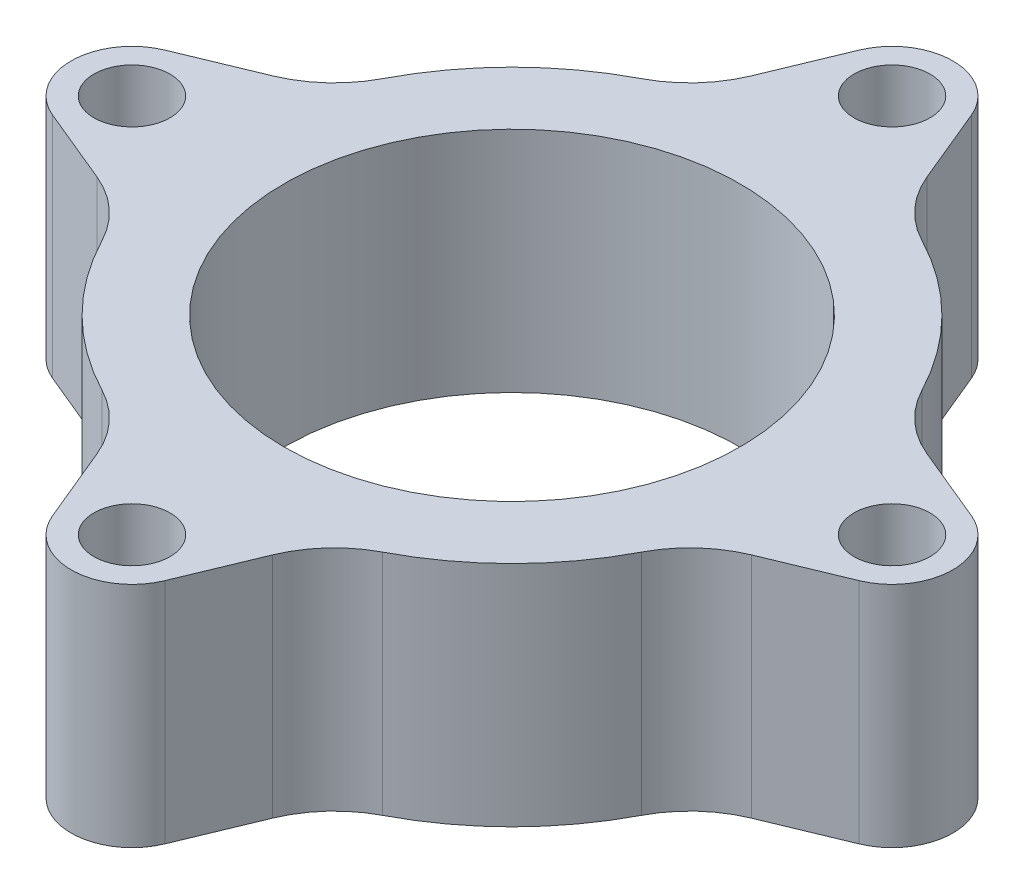
from build123d import *

# Parameters (mm, degrees)
SKETCH1_R           = 30
SKETCH1_R_2         = 5
BOSS_EXTRUDE1_DEPTH = 15
FILLET1_R           = 15


with BuildPart() as part:
    # Sketch1 → Boss-Extrude1 (new, symmetric)
    with BuildSketch(Plane(origin=(0, 0, 0), x_dir=(1, 0, 0), z_dir=(0, 1, 0))):
        with BuildLine():
            Line((13.821869985, 37.536061462), (7.39103626, 53.061467459))
            ThreePointArc((7.39103626, 53.061467459), (0, 58), (-7.39103626, 53.061467459))
            Line((-7.39103626, 53.061467459), (-13.821869985, 37.536061462))
            ThreePointArc((-13.821869985, 37.536061462), (-28.284271247, 28.284271247), (-37.536061462, 13.821869985))
            Line((-37.536061462, 13.821869985), (-53.061467459, 7.39103626))
            ThreePointArc((-53.061467459, 7.39103626), (-58, 0), (-53.061467459, -7.39103626))
            Line((-53.061467459, -7.39103626), (-37.536061462, -13.821869985))
            ThreePointArc((-37.536061462, -13.821869985), (-28.284271247, -28.284271247), (-13.821869985, -37.536061462))
            Line((-13.821869985, -37.536061462), (-7.39103626, -53.061467459))
            ThreePointArc((-7.39103626, -53.061467459), (0, -58), (7.39103626, -53.061467459))
            Line((7.39103626, -53.061467459), (13.821869985, -37.536061462))
            ThreePointArc((13.821869985, -37.536061462), (28.284271247, -28.284271247), (37.536061462, -13.821869985))
            Line((37.536061462, -13.821869985), (53.061467459, -7.39103626))
            ThreePointArc((53.061467459, -7.39103626), (58, 0), (53.061467459, 7.39103626))
            Line((53.061467459, 7.39103626), (37.536061462, 13.821869985))
            ThreePointArc((37.536061462, 13.821869985), (28.284271247, 28.284271247), (13.821869985, 37.536061462))
        make_face()
        with Locations(Location((0, 0, 0), (0, 0, 270))):
            Circle(SKETCH1_R, mode=Mode.SUBTRACT)
        with Locations(Location((0, 50, 0), (0, 0, 270))):
            Circle(SKETCH1_R_2, mode=Mode.SUBTRACT)
        with Locations(Location((-50, 0, 0), (0, 0, 270))):
            Circle(SKETCH1_R_2, mode=Mode.SUBTRACT)
        with Locations(Location((50, 0, 0), (0, 0, 270))):
            Circle(SKETCH1_R_2, mode=Mode.SUBTRACT)
        with Locations(Location((0, -50, 0), (0, 0, 270))):
            Circle(SKETCH1_R_2, mode=Mode.SUBTRACT)
    extrude(amount=BOSS_EXTRUDE1_DEPTH, both=True)

    # Fillet1
    fillet1_edges = [part.edges().sort_by_distance(p)[0] for p in [
        (-37.536061462, 0, -13.821869985),
        (-13.821869985, 0, -37.536061462),
        (13.821869985, 0, -37.536061462),
        (37.536061462, 0, -13.821869985),
        (37.536061462, 0, 13.821869985),
        (13.821869985, 0, 37.536061462),
        (-13.821869985, 0, 37.536061462),
        (-37.536061462, 0, 13.821869985),
    ]]
    fillet(fillet1_edges, radius=FILLET1_R)


solid = part.part
